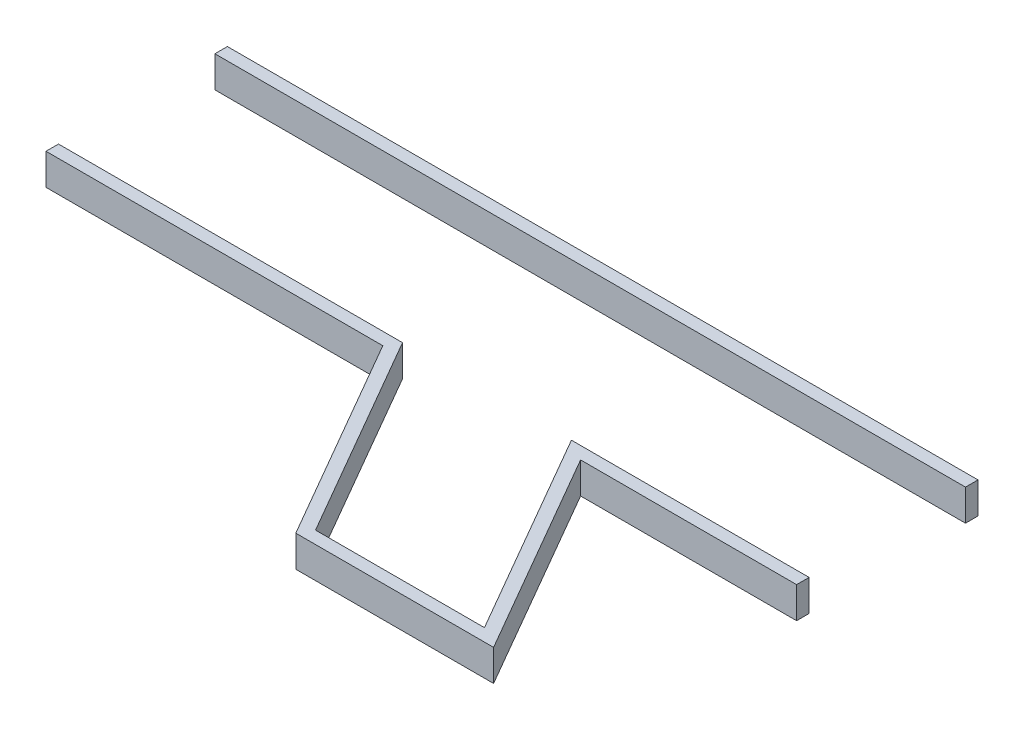
from build123d import *

# Parameters (mm, degrees)
EXTRUDE_1_DEPTH   = 50
SKETCH_1_W        = 1200
SKETCH_1_H        = 20
EXTRUDE_1_2_DEPTH = 50


with BuildPart() as part:
    # 草图1 → 凸台-拉伸1 (new body)
    with BuildSketch(Plane(origin=(0, 0, 0), x_dir=(1, 0, 0), z_dir=(0, 1, 0))):
        Polygon((-50, -125), (140, -454.089653438), (410, -454.089653438), (220, -125), (600, -125), (600, -145), (254.641016151, -145), (444.641016151, -474.089653438), (128.452994616, -474.089653438), (-61.547005384, -145), (-600, -145), (-600, -125), align=None)
    extrude(amount=EXTRUDE_1_DEPTH)


with BuildPart() as body_2:
    # 草图1 → Extrude 1 2 (new body)
    with BuildSketch(Plane(origin=(0, 0, 0), x_dir=(1, 0, 0), z_dir=(0, 1, 0))):
        with Locations((0, 135)):
            Rectangle(SKETCH_1_W, SKETCH_1_H)
    extrude(amount=EXTRUDE_1_2_DEPTH)


solid = Compound([part.part, body_2.part])
